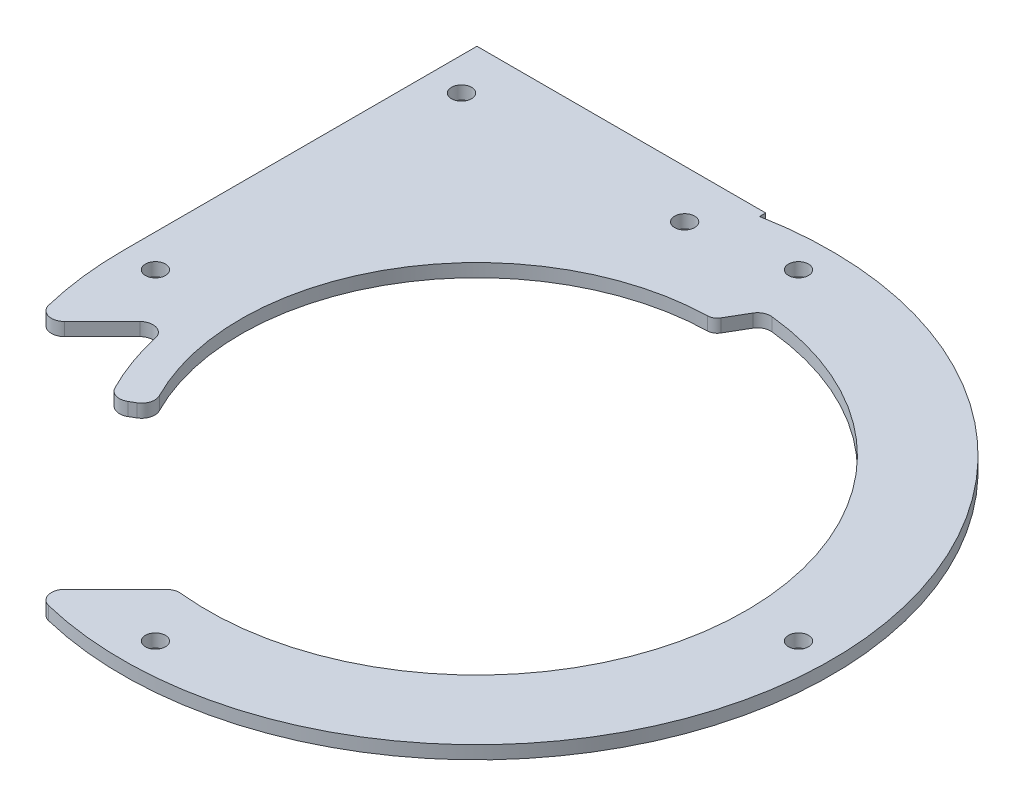
from build123d import *

# Parameters (mm, degrees)
SKETCH_1_R          = 41
SKETCH_1_R_2        = 1.525
EXTRUDE_1_DEPTH     = 2
EXTRUDE_3_DEPTH     = 2
FILLET_1_R          = 2
EXTRUDE_5_DEPTH     = 2
CUT_EXTRUDE_1_DEPTH = 10
FILLET_3_R          = 2


with BuildPart() as part:
    # 草图1 → 凸台-拉伸1 (new body)
    with BuildSketch(Plane(origin=(0, 0, 0), x_dir=(1, 0, 0), z_dir=(0, 1, 0))):
        with BuildLine():
            Line((-54, 0), (-54, 54))
            Line((-54, 54), (-10, 54))
            Line((-10, 54), (-10, 53.065996646))
            ThreePointArc((-10, 53.065996646), (41.569219382, -34.467375879), (-54, 0))
        make_face()
        with Locations(Location((0, 0, 0), (0, 0, 270))):
            Circle(SKETCH_1_R, mode=Mode.SUBTRACT)
        with Locations(Location((-15, 46.647615159, 0), (0, 0, 270))):
            Circle(SKETCH_1_R_2, mode=Mode.SUBTRACT)
        with Locations(Location((0, 49, 0), (0, 0, 270))):
            Circle(SKETCH_1_R_2, mode=Mode.SUBTRACT)
        with Locations(Location((49, 0, 0), (0, 0, 270))):
            Circle(SKETCH_1_R_2, mode=Mode.SUBTRACT)
        with Locations(Location((0, -49, 0), (0, 0, 270))):
            Circle(SKETCH_1_R_2, mode=Mode.SUBTRACT)
        with Locations(Location((-49, 0, 0), (0, 0, 270))):
            Circle(SKETCH_1_R_2, mode=Mode.SUBTRACT)
        with Locations(Location((-49, 46.647615159, 0), (0, 0, 270))):
            Circle(SKETCH_1_R_2, mode=Mode.SUBTRACT)
    extrude(amount=EXTRUDE_1_DEPTH)

    # 草图2 → 凸台-拉伸3 (add)
    with BuildSketch(Plane(origin=(0, 0, 0), x_dir=(1, 0, 0), z_dir=(0, 1, 0))):
        with BuildLine():
            Line((-41, 0), (-37.46998799, 0))
            ThreePointArc((-37.46998799, 0), (-36.430757506, 0.418334617), (-35.971188471, 1.44))
            ThreePointArc((-35.971188471, 1.44), (-25.240038288, 25.669835746), (-0.832477451, 35.990373453))
            ThreePointArc((-0.832477451, 35.990373453), (-0.105240976, 36.197891356), (0.428319211, 36.733848535))
            Line((0.428319211, 36.733848535), (2.860015424, 40.900126061))
            ThreePointArc((2.860015424, 40.900126061), (-27.961932763, 29.985501766), (-41, 0))
        make_face()
    extrude(amount=EXTRUDE_3_DEPTH)

    # 圆角1
    fillet_1_edges = [part.edges().sort_by_distance(p)[0] for p in [
        (2.860015424, 1, -40.900126061),
        (-41, 1, 0),
    ]]
    fillet(fillet_1_edges, radius=FILLET_1_R)

    # 草图4 → 凸台-拉伸5 (add)
    with BuildSketch(Plane.XZ):
        with BuildLine():
            Line((-38.948684188, 0), (-37.46998799, 0))
            ThreePointArc((-37.46998799, 0), (-36.430757506, -0.418334617), (-35.971188471, -1.44))
            ThreePointArc((-35.971188471, -1.44), (-34.952758609, 8.620015408), (-31.176914536, 18))
            Line((-31.176914536, 18), (-35.507041555, 20.5))
            ThreePointArc((-35.507041555, 20.5), (-39.317748075, 11.623884304), (-40.946052608, 2.102564103))
            ThreePointArc((-40.946052608, 2.102564103), (-40.398706292, 0.622525537), (-38.948684188, 0))
        make_face()
    extrude(amount=-EXTRUDE_5_DEPTH)

    # 草图5 → 切除-拉伸1 (cut)
    with BuildSketch(Plane.XZ):
        with BuildLine():
            Line((-16.167566472, 51.522905531), (-5.300581056, 40.655920116))
            ThreePointArc((-5.300581056, 40.655920116), (-28.991378029, 28.991378029), (-40.655920116, 5.300581056))
            Line((-40.655920116, 5.300581056), (-51.522905531, 16.167566472))
            ThreePointArc((-51.522905531, 16.167566472), (-38.183766184, 38.183766184), (-16.167566472, 51.522905531))
        make_face()
    extrude(amount=-CUT_EXTRUDE_1_DEPTH, mode=Mode.SUBTRACT)

    # 圆角3
    fillet_3_edges = [part.edges().sort_by_distance(p)[0] for p in [
        (-5.300581056, 1, 40.655920116),
        (-40.655920116, 1, 5.300581056),
        (-35.507041555, 1, 20.5),
        (-31.176914536, 1, 18),
        (-51.522905531, 1, 16.167566472),
        (-16.167566472, 1, 51.522905531),
    ]]
    fillet(fillet_3_edges, radius=FILLET_3_R)


solid = part.part
